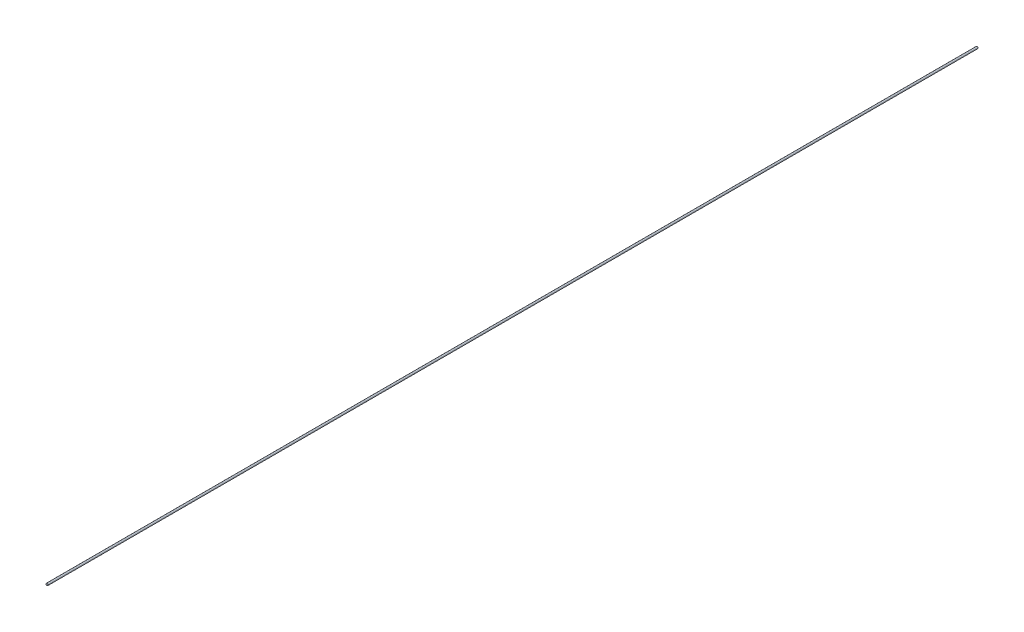
from build123d import *

# Parameters (mm, degrees)
ESBO_O1_R                = 5
RESSALTO_EXTRUS_O1_DEPTH = 2370


with BuildPart() as part:
    # Esboço1 → Ressalto-extrusão1 (new, symmetric)
    with BuildSketch(Plane.XY):
        with Locations(Location((0, 0, 0), (0, 0, 180))):
            Circle(ESBO_O1_R)
    extrude(amount=RESSALTO_EXTRUS_O1_DEPTH, both=True)


solid = part.part
